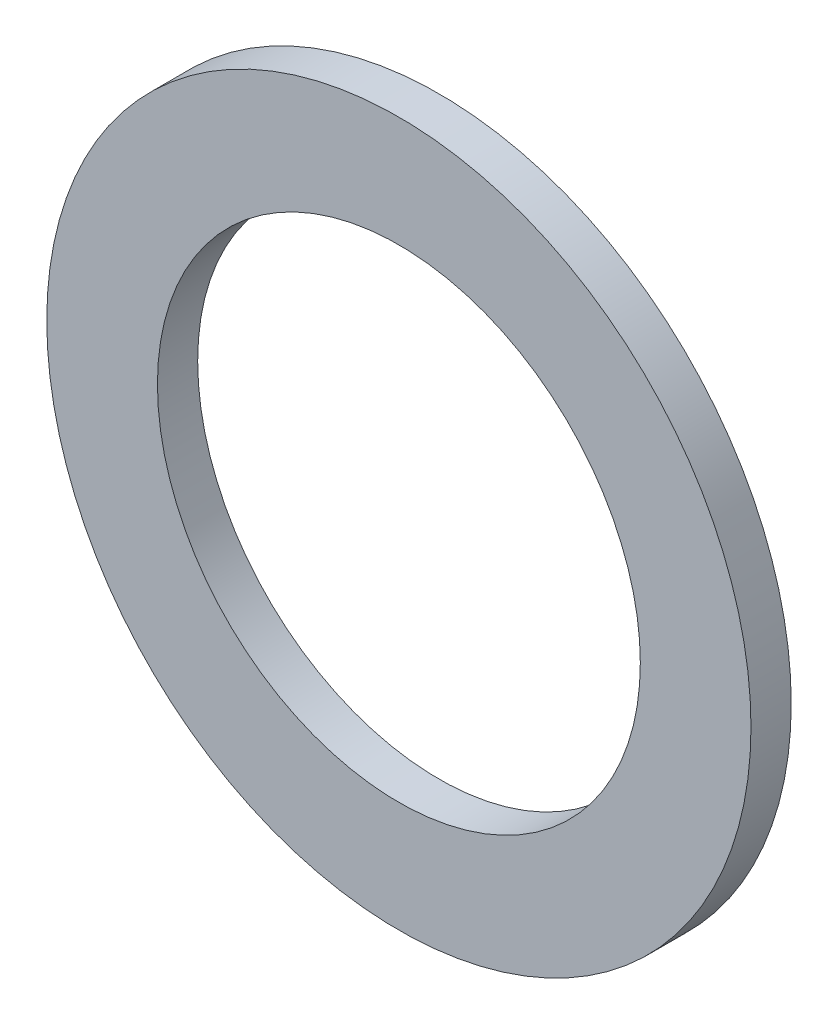
from build123d import *

# Parameters (mm, degrees)
SKETCH1_R           = 8.75
SKETCH1_R_2         = 6
BOSS_EXTRUDE1_DEPTH = 1


with BuildPart() as part:
    # Sketch1 → Boss-Extrude1 (new body)
    with BuildSketch(Plane.XY):
        Circle(SKETCH1_R)
        Circle(SKETCH1_R_2, mode=Mode.SUBTRACT)
    extrude(amount=-BOSS_EXTRUDE1_DEPTH)


solid = part.part
